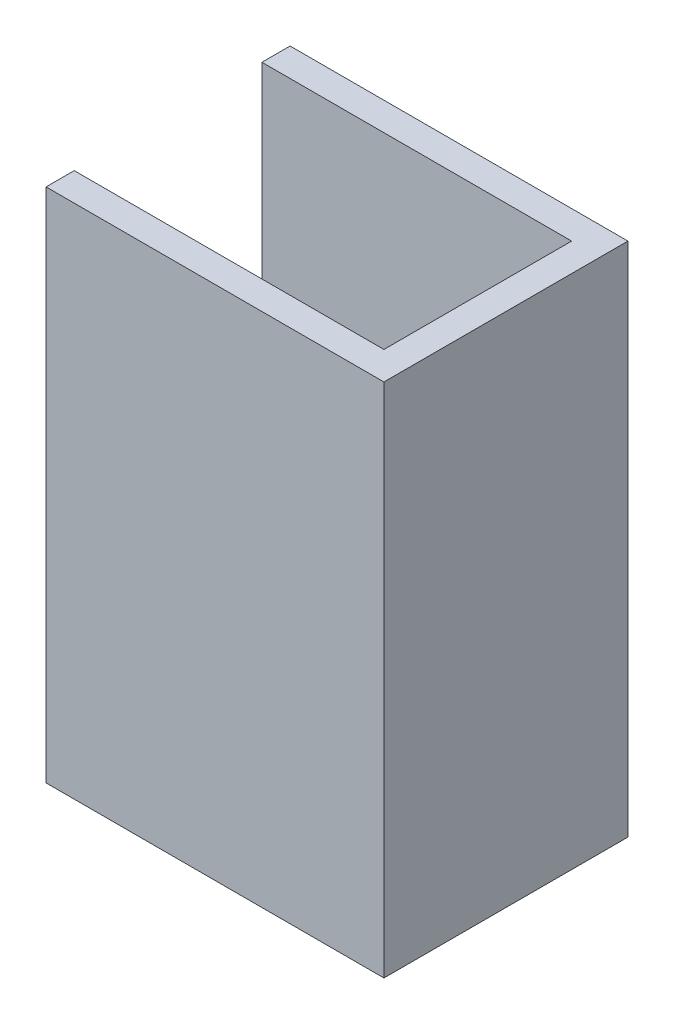
from build123d import *

# Parameters (mm, degrees)
ESQUISSE1_W             = 36
ESQUISSE1_H             = 80
BOSS_EXTRU_1_DEPTH      = 3
ESQUISSE2_W             = 3
ESQUISSE2_H             = 55
BOSS_EXTRU_2_DEPTH      = 23
ESQUISSE3_W             = 3
ESQUISSE3_H             = 55
BOSS_EXTRU_3_DEPTH      = 33
ESQUISSE4_W             = 36
ESQUISSE4_H             = 25
ENL_V_MAT_EXTRU_1_DEPTH = 33


with BuildPart() as part:
    # Esquisse1 → Boss.-Extru.1 (new body)
    with BuildSketch(Plane.XY):
        with Locations((-27.15451692, 0.732402707)):
            Rectangle(ESQUISSE1_W, ESQUISSE1_H)
    extrude(amount=BOSS_EXTRU_1_DEPTH)

    # Esquisse2 → Boss.-Extru.2 (add)
    with BuildSketch(Plane(origin=(0, 0, 0), x_dir=(-1, 0, 0), z_dir=(0, 0, -1))):
        with Locations((10.65451692, 13.232402707)):
            Rectangle(ESQUISSE2_W, ESQUISSE2_H)
    extrude(amount=BOSS_EXTRU_2_DEPTH)

    # Esquisse3 → Boss.-Extru.3 (add)
    with BuildSketch(Plane.ZY.offset(12.15451692)):
        with Locations((-21.5, 13.232402707)):
            Rectangle(ESQUISSE3_W, ESQUISSE3_H)
    extrude(amount=BOSS_EXTRU_3_DEPTH)

    # Esquisse4 → Enlèv. mat.-Extru.1 (cut)
    with BuildSketch(Plane(origin=(0, 0, 0), x_dir=(-1, 0, 0), z_dir=(0, 0, -1))):
        with Locations((27.15451692, -26.767597293)):
            Rectangle(ESQUISSE4_W, ESQUISSE4_H)
    extrude(amount=-ENL_V_MAT_EXTRU_1_DEPTH, mode=Mode.SUBTRACT)


solid = part.part
